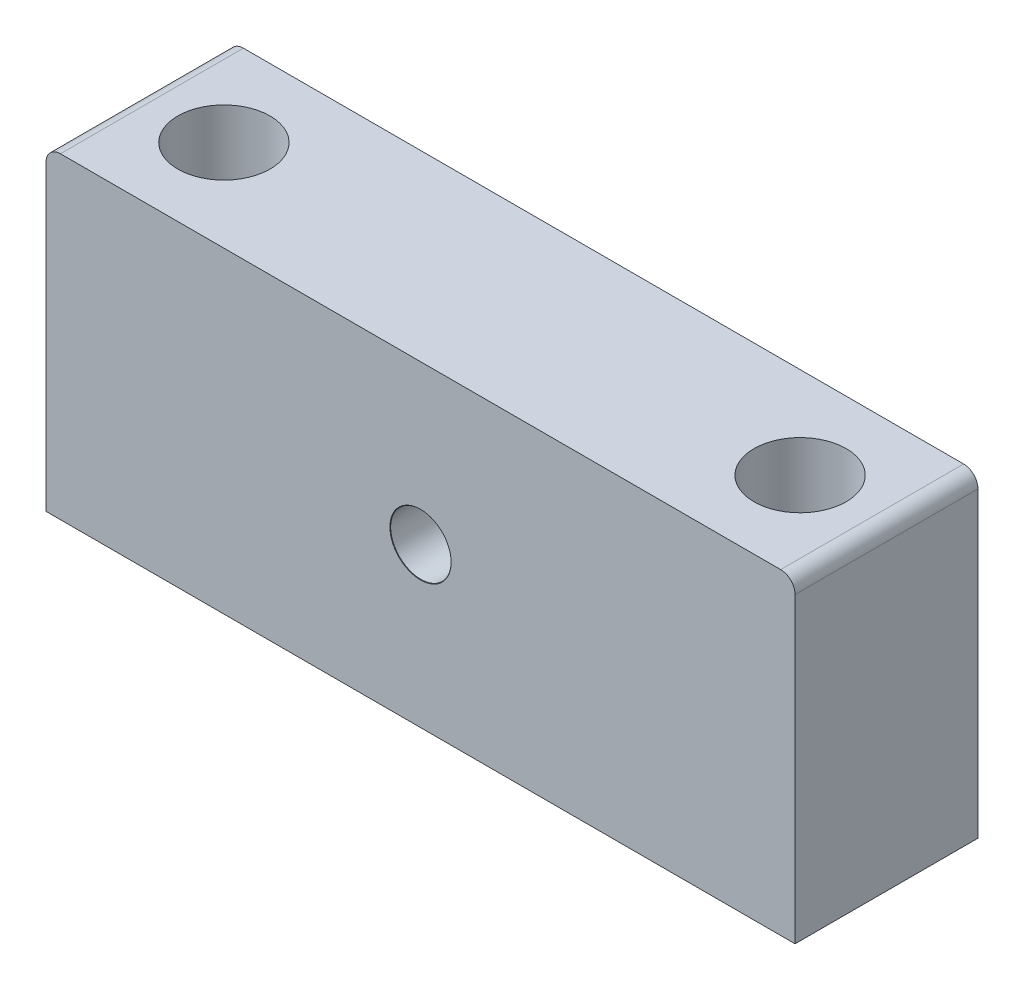
from build123d import *

# Parameters (mm, degrees)
BOSS_EXTRUDE1_DEPTH                   = 12.7
TAP_DRILL_FOR_M5X0_8_TAP1_D           = 4.2
TAP_DRILL_FOR_M5X0_8_TAP1_CSINK_D     = 4.25
TAP_DRILL_FOR_M5X0_8_TAP1_CSINK_ANGLE = 90
M6_CLEARANCE_HOLE1_D                  = 6.4
M6_CLEARANCE_HOLE1_CSINK_D            = 6.65
M6_CLEARANCE_HOLE1_CSINK_ANGLE        = 90
FILLET1_R                             = 1


with BuildPart() as part:
    # Sketch1 → Boss-Extrude1 (new body)
    with BuildSketch(Plane.XY):
        Polygon((-26, 0), (26, 0), (26, 6), (26, 22), (7.5, 22), (-7.5, 22), (-26, 22), (-26, 6), align=None)
    extrude(amount=-BOSS_EXTRUDE1_DEPTH)

    # Tap Drill for M5x0.8 Tap1 (through all)
    with Locations(Plane(origin=(0, 11, 0), x_dir=(1, 0, 0), z_dir=(0, 0, 1))):
        with Locations((0, 0)):
            CounterSinkHole(TAP_DRILL_FOR_M5X0_8_TAP1_D / 2, TAP_DRILL_FOR_M5X0_8_TAP1_CSINK_D / 2, counter_sink_angle=TAP_DRILL_FOR_M5X0_8_TAP1_CSINK_ANGLE)

    # M6 Clearance Hole1 (through all)
    with Locations(Plane(origin=(-20, 0, -6.35), x_dir=(-1, 0, 0), z_dir=(0, -1, 0))):
        with Locations((0, 0), (-40, 0)):
            CounterSinkHole(M6_CLEARANCE_HOLE1_D / 2, M6_CLEARANCE_HOLE1_CSINK_D / 2, counter_sink_angle=M6_CLEARANCE_HOLE1_CSINK_ANGLE)

    # Fillet1
    fillet1_edges = [part.edges().sort_by_distance(p)[0] for p in [
        (-26, 22, -6.35),
        (26, 22, -6.35),
    ]]
    fillet(fillet1_edges, radius=FILLET1_R)


solid = part.part
